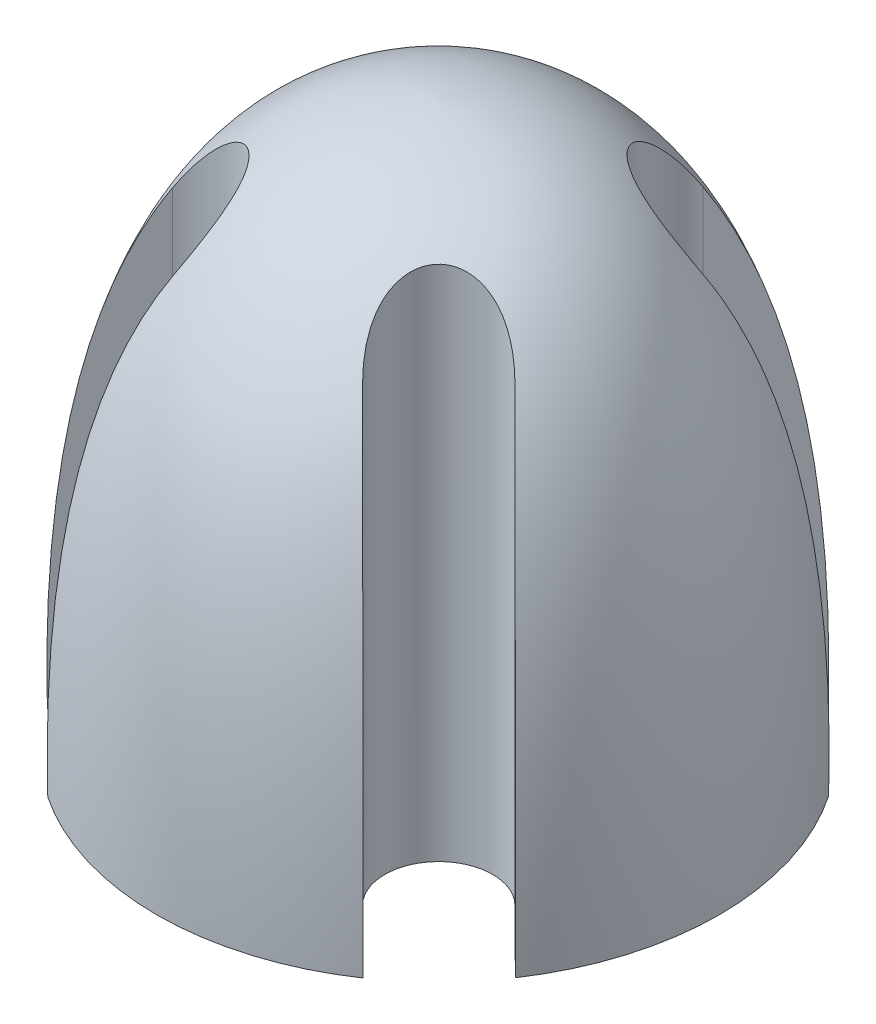
from build123d import *

# Parameters (mm, degrees)
SKETCH3_R          = 2.000000064
CUT_EXTRUDE1_DEPTH = 6.99999997
CUT_EXTRUDE3_REACH = 48.683


with BuildPart() as part:
    # Sketch1 → Revolve1 (revolve)
    with BuildSketch(Plane.XY):
        with BuildLine():
            Line((0, 0), (0, 38.1))
            add(Edge.make_bspline(
                [(0, 38.1), (19.753060043, 37.128354082), (19.05, 0)],
                knots=[0, 0, 0, 1, 1, 1], degree=2))
            Line((19.05, 0), (0, 0))
        make_face()
    revolve(axis=Axis((0, 0, 0), (0, 1, 0)))

    # Sketch3 → Cut-Extrude1 (cut)
    with BuildSketch(Plane.XZ):
        with Locations(Location((12.7, 0, 0), (0, 0, 270))):
            Circle(SKETCH3_R)
        with Locations(Location((-12.7, 0, 0), (0, 0, 270))):
            Circle(SKETCH3_R)
        with Locations(Location((0, 12.7, 0), (0, 0, 270))):
            Circle(SKETCH3_R)
        with Locations(Location((0, -12.7, 0), (0, 0, 270))):
            Circle(SKETCH3_R)
    extrude(amount=-CUT_EXTRUDE1_DEPTH, mode=Mode.SUBTRACT)

    # Sketch4 → Cut-Extrude3 (cut, up to next)
    with BuildSketch(Plane.XZ, mode=Mode.PRIVATE) as cut_extrude3_sk1:
        with BuildLine():
            Line((20.585051469, 15.321285367), (11.579529978, 6.366365899))
            ThreePointArc((11.579529978, 6.366365899), (6.416967921, 6.38091098), (6.431513003, 11.543473038))
            Line((6.431513003, 11.543473038), (15.437034493, 20.498392506))
            ThreePointArc((15.437034493, 20.498392506), (20.599596551, 20.483847424), (20.585051469, 15.321285367))
        make_face()
    cut_extrude3_tool1 = extrude(cut_extrude3_sk1.sketch, amount=-CUT_EXTRUDE3_REACH, mode=Mode.PRIVATE) & part.part
    # Sketch4 → Cut-Extrude3 (cut, up to next)
    with BuildSketch(Plane.XZ, mode=Mode.PRIVATE) as cut_extrude3_sk2:
        with BuildLine():
            Line((15.321285367, -20.585051469), (6.366365899, -11.579529978))
            ThreePointArc((6.366365899, -11.579529978), (6.38091098, -6.416967921), (11.543473038, -6.431513003))
            Line((11.543473038, -6.431513003), (20.498392506, -15.437034493))
            ThreePointArc((20.498392506, -15.437034493), (20.483847424, -20.599596551), (15.321285367, -20.585051469))
        make_face()
    cut_extrude3_tool2 = extrude(cut_extrude3_sk2.sketch, amount=-CUT_EXTRUDE3_REACH, mode=Mode.PRIVATE) & part.part
    # Sketch4 → Cut-Extrude3 (cut, up to next)
    with BuildSketch(Plane.XZ, mode=Mode.PRIVATE) as cut_extrude3_sk3:
        with BuildLine():
            Line((-20.585051469, -15.321285367), (-11.579529978, -6.366365899))
            ThreePointArc((-11.579529978, -6.366365899), (-6.416967921, -6.38091098), (-6.431513003, -11.543473038))
            Line((-6.431513003, -11.543473038), (-15.437034493, -20.498392506))
            ThreePointArc((-15.437034493, -20.498392506), (-20.599596551, -20.483847424), (-20.585051469, -15.321285367))
        make_face()
    cut_extrude3_tool3 = extrude(cut_extrude3_sk3.sketch, amount=-CUT_EXTRUDE3_REACH, mode=Mode.PRIVATE) & part.part
    # Sketch4 → Cut-Extrude3 (cut, up to next)
    with BuildSketch(Plane.XZ, mode=Mode.PRIVATE) as cut_extrude3_sk4:
        with BuildLine():
            Line((-15.321285367, 20.585051469), (-6.366365899, 11.579529978))
            ThreePointArc((-6.366365899, 11.579529978), (-6.38091098, 6.416967921), (-11.543473038, 6.431513003))
            Line((-11.543473038, 6.431513003), (-20.498392506, 15.437034493))
            ThreePointArc((-20.498392506, 15.437034493), (-20.483847424, 20.599596551), (-15.321285367, 20.585051469))
        make_face()
    cut_extrude3_tool4 = extrude(cut_extrude3_sk4.sketch, amount=-CUT_EXTRUDE3_REACH, mode=Mode.PRIVATE) & part.part
    add(cut_extrude3_tool1.solids().sort_by_distance((13.508282, 0, 13.432379))[0], mode=Mode.SUBTRACT)
    add(cut_extrude3_tool2.solids().sort_by_distance((13.432379, 0, -13.508282))[0], mode=Mode.SUBTRACT)
    add(cut_extrude3_tool3.solids().sort_by_distance((-13.508282, 0, -13.432379))[0], mode=Mode.SUBTRACT)
    add(cut_extrude3_tool4.solids().sort_by_distance((-13.432379, 0, 13.508282))[0], mode=Mode.SUBTRACT)


solid = part.part
